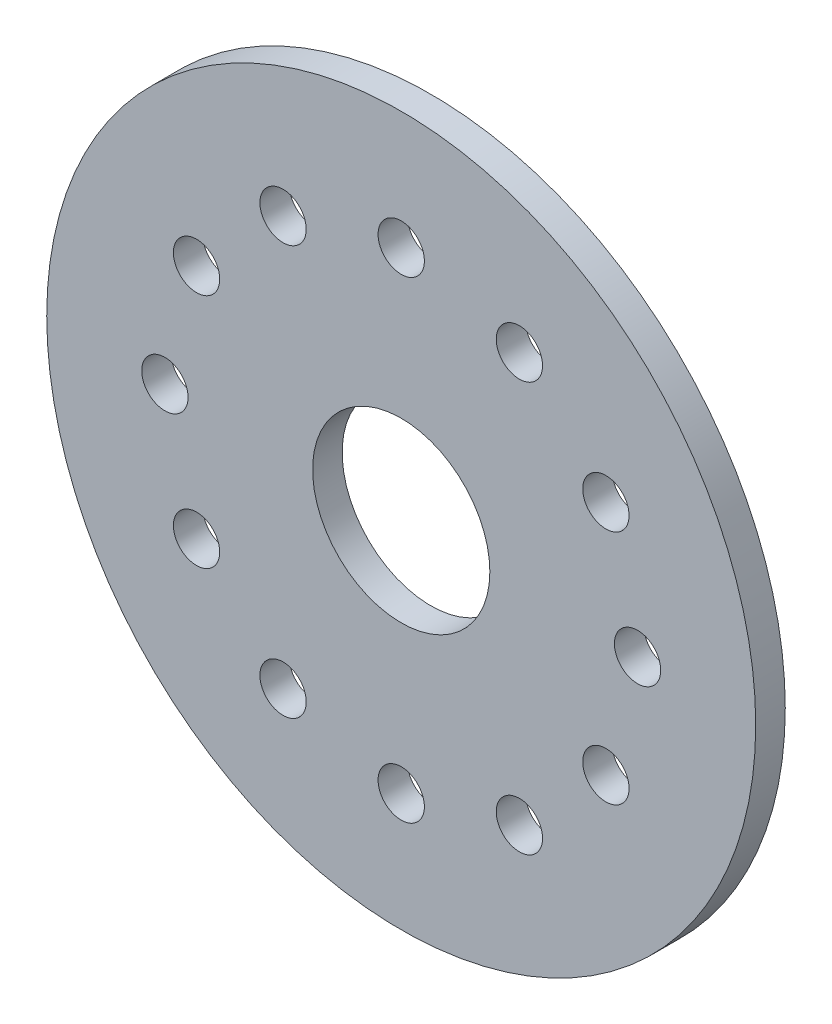
from build123d import *

# Parameters (mm, degrees)
SKETCH1_R           = 38.1
SKETCH1_R_2         = 9.525
SKETCH1_R_3         = 2.4892
BOSS_EXTRUDE1_DEPTH = 3.175


with BuildPart() as part:
    # Sketch1 → Boss-Extrude1 (new body)
    with BuildSketch(Plane.XY):
        Circle(SKETCH1_R)
        Circle(SKETCH1_R_2, mode=Mode.SUBTRACT)
        with Locations((0, 25.4)):
            Circle(SKETCH1_R_3, mode=Mode.SUBTRACT)
        with Locations((12.7, 21.997045256)):
            Circle(SKETCH1_R_3, mode=Mode.SUBTRACT)
        with Locations((21.997045256, 12.7)):
            Circle(SKETCH1_R_3, mode=Mode.SUBTRACT)
        with Locations((25.4, 0)):
            Circle(SKETCH1_R_3, mode=Mode.SUBTRACT)
        with Locations((21.997045256, -12.7)):
            Circle(SKETCH1_R_3, mode=Mode.SUBTRACT)
        with Locations((12.7, -21.997045256)):
            Circle(SKETCH1_R_3, mode=Mode.SUBTRACT)
        with Locations((0, -25.4)):
            Circle(SKETCH1_R_3, mode=Mode.SUBTRACT)
        with Locations((-12.7, -21.997045256)):
            Circle(SKETCH1_R_3, mode=Mode.SUBTRACT)
        with Locations((-21.997045256, -12.7)):
            Circle(SKETCH1_R_3, mode=Mode.SUBTRACT)
        with Locations((-25.4, 0)):
            Circle(SKETCH1_R_3, mode=Mode.SUBTRACT)
        with Locations((-21.997045256, 12.7)):
            Circle(SKETCH1_R_3, mode=Mode.SUBTRACT)
        with Locations((-12.7, 21.997045256)):
            Circle(SKETCH1_R_3, mode=Mode.SUBTRACT)
    extrude(amount=BOSS_EXTRUDE1_DEPTH)


solid = part.part
